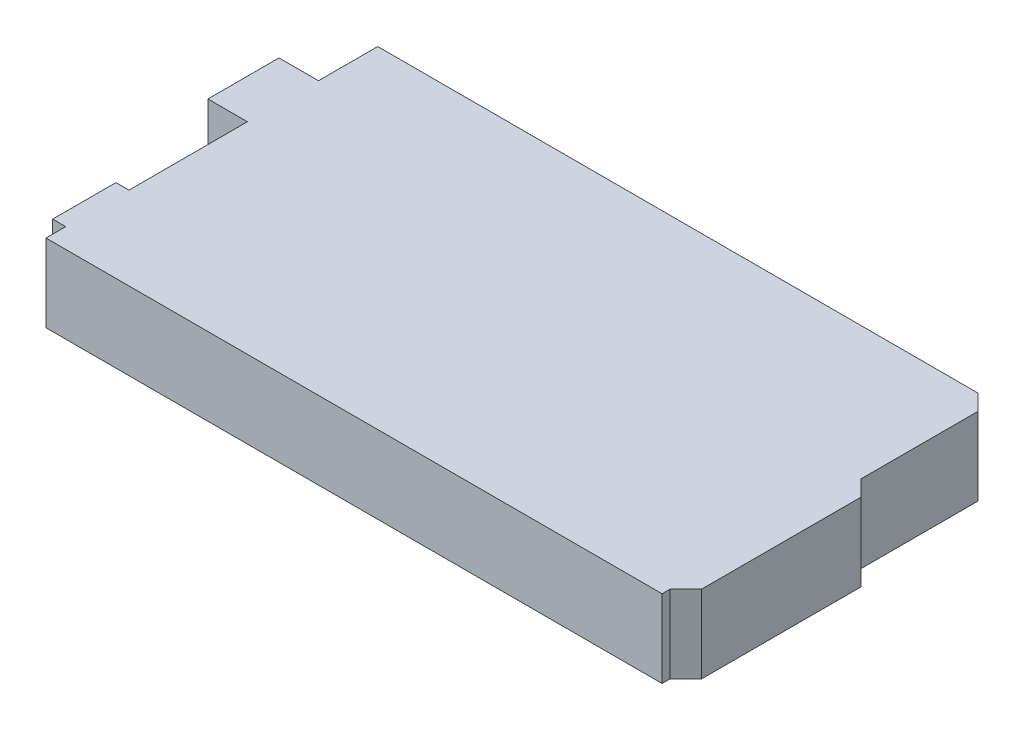
from build123d import *

# Parameters (mm, degrees)
BOSS_EXTRUDE1_DEPTH = 12.5


with BuildPart() as part:
    # Sketch1 → Boss-Extrude1 (new body)
    with BuildSketch(Plane(origin=(0, 0, 0), x_dir=(1, 0, 0), z_dir=(0, 1, 0))):
        Polygon((-118.858974359, -25.595384615), (-118.858974359, -22.420384615), (-120.958974359, -22.420384615), (-120.958974359, -12.260384615), (-118.858974359, -12.260384615), (-118.858974359, 6.789615385), (-125.208974359, 6.789615385), (-125.208974359, 18.219615385), (-118.858974359, 18.219615385), (-118.858974359, 27.744615385), (-22.338974359, 27.744615385), (-19.798974359, 25.204615385), (-19.798974359, 6.382564103), (-17.258974359, 3.842564103), (-17.258974359, -21.785384615), (-19.798974359, -24.325384615), (-19.798974359, -25.595384615), align=None)
    extrude(amount=BOSS_EXTRUDE1_DEPTH)


solid = part.part
